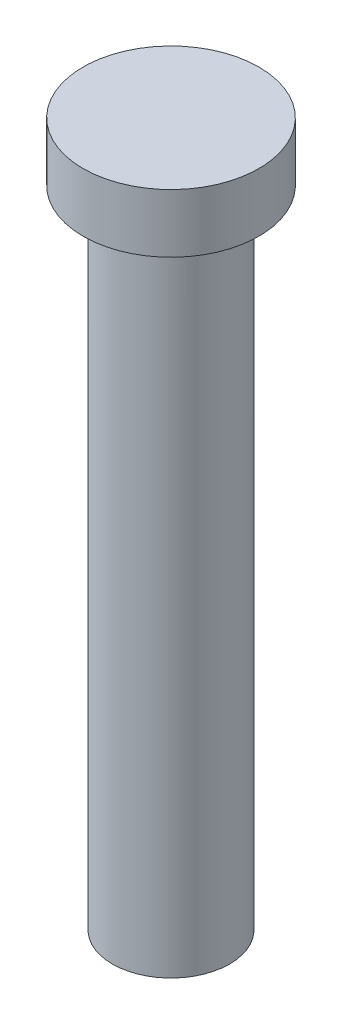
from build123d import *

# Parameters (mm, degrees)
SKETCH1_R           = 4.7625
BOSS_EXTRUDE1_DEPTH = 3.175
SKETCH2_R           = 3.175
BOSS_EXTRUDE2_DEPTH = 34.925


with BuildPart() as part:
    # Sketch1 → Boss-Extrude1 (new body)
    with BuildSketch(Plane(origin=(0, 0, 0), x_dir=(1, 0, 0), z_dir=(0, 1, 0))):
        with Locations(Location((0, 0, 0), (0, 0, 270))):
            Circle(SKETCH1_R)
    extrude(amount=BOSS_EXTRUDE1_DEPTH)

    # Sketch2 → Boss-Extrude2 (add)
    with BuildSketch(Plane.XZ):
        with Locations(Location((0, 0, 0), (0, 0, 90))):
            Circle(SKETCH2_R)
    extrude(amount=BOSS_EXTRUDE2_DEPTH)


solid = part.part
